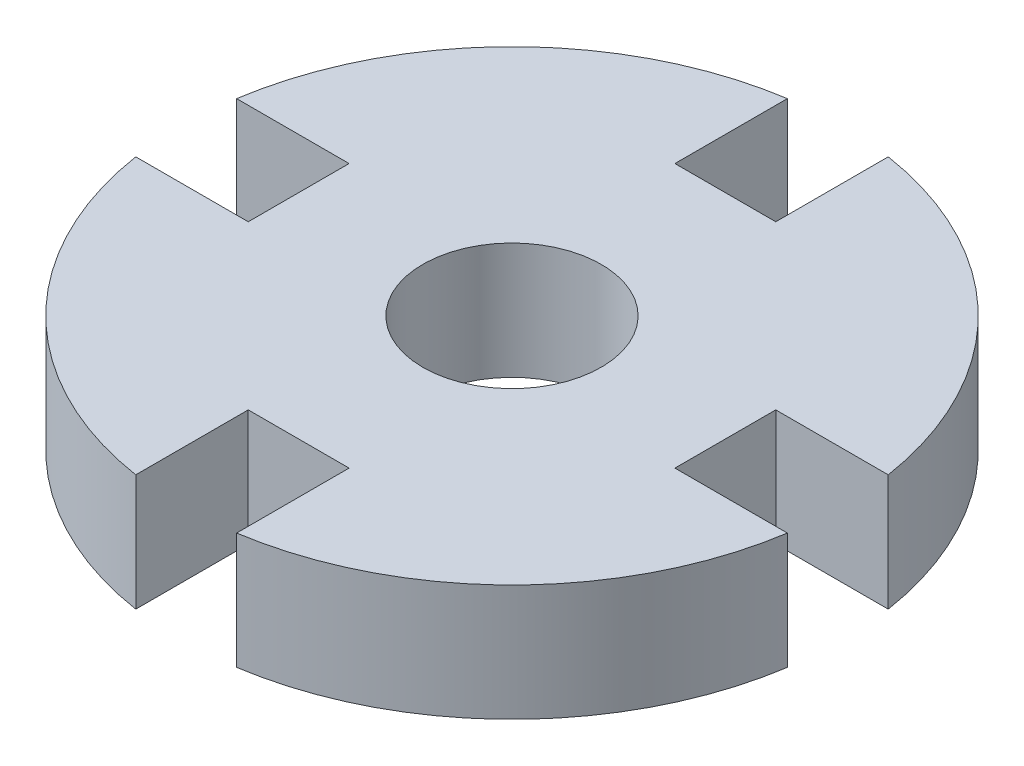
from build123d import *

# Parameters (mm, degrees)
BOSS_EXTRUDE1_DEPTH      = 1.5
BOSS_EXTRUDE1_DEPTH_BACK = 1.5
SKETCH1_R                = 8.5
SKETCH1_R_2              = 2.3
SKETCH2_W                = 3
SKETCH2_H                = 2.6
SKETCH2_W_2              = 2.6
SKETCH2_H_2              = 3
CUT_EXTRUDE1_DEPTH       = 13.389511693


with BuildPart() as part:
    # Sketch1 → Boss-Extrude1 (new, two sides: drawn at the far end of the back side and taken through both)
    with BuildSketch(Plane(origin=(0, 0, 0), x_dir=(1, 0, 0), z_dir=(0, 1, 0)).offset(-BOSS_EXTRUDE1_DEPTH_BACK)):
        Circle(SKETCH1_R)
        Circle(SKETCH1_R_2, mode=Mode.SUBTRACT)
    extrude(amount=BOSS_EXTRUDE1_DEPTH + BOSS_EXTRUDE1_DEPTH_BACK)

    # Sketch2 → Cut-Extrude1 (cut, through all)
    with BuildSketch(Plane(origin=(0, 1.5, 0), x_dir=(1, 0, 0), z_dir=(0, 1, 0))):
        with Locations((-7, 0)):
            Rectangle(SKETCH2_W, SKETCH2_H)
        with Locations((0, -7)):
            Rectangle(SKETCH2_W_2, SKETCH2_H_2)
        with Locations((0, 7)):
            Rectangle(SKETCH2_W_2, SKETCH2_H_2)
        with Locations((7, 0)):
            Rectangle(SKETCH2_W, SKETCH2_H)
    extrude(amount=-CUT_EXTRUDE1_DEPTH, mode=Mode.SUBTRACT)


solid = part.part
